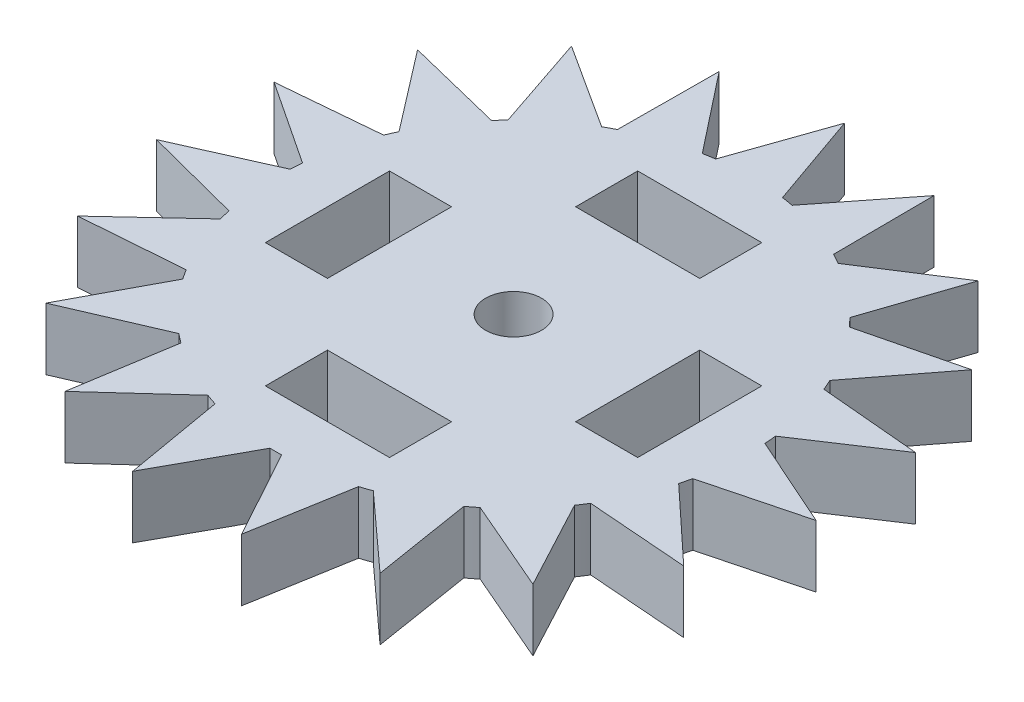
from build123d import *

# Parameters (mm, degrees)
SKETCH5_R           = 11.5
BOSS_EXTRUDE2_DEPTH = 3
BOSS_EXTRUDE1_DEPTH = 3
SKETCH3_W           = 6
SKETCH3_H           = 3
SKETCH3_W_2         = 3
SKETCH3_H_2         = 6
CUT_EXTRUDE1_DEPTH  = 3
SKETCH6_R           = 1.35
CUT_EXTRUDE3_DEPTH  = 3


with BuildPart() as part:
    # Sketch5 → Boss-Extrude2 (new body)
    with BuildSketch(Plane(origin=(0, 0, 0), x_dir=(1, 0, 0), z_dir=(0, 1, 0))):
        with Locations(Location((0, 0, 0), (0, 0, 270))):
            Circle(SKETCH5_R)
    extrude(amount=BOSS_EXTRUDE2_DEPTH)

    # Sketch1 → Boss-Extrude1 (add)
    with BuildSketch(Plane(origin=(0, 0, 0), x_dir=(1, 0, 0), z_dir=(0, 1, 0))):
        Polygon((0, 16), (-1.75, 11), (1.75, 11), align=None)
        Polygon((5.195191507, 15.133075867), (1.916513988, 10.97221373), (5.226874334, 9.835765588), align=None)
        Polygon((9.827403403, 12.62624815), (5.375343948, 9.755417851), (8.137335731, 7.605673356), align=None)
        Polygon((13.394663652, 8.75117053), (8.251671984, 7.481471076), (10.165990538, 4.551388402), align=None)
        Polygon((15.510404255, 3.927767794), (10.233803323, 4.396790824), (11.093002528, 1.003889893), align=None)
        Polygon((15.945351888, -1.321269528), (11.106943278, 0.835650063), (10.817915568, -2.652395663), align=None)
        Polygon((14.652373226, -6.427126794), (10.776473586, -2.81604635), (9.3705396, -6.021252993), align=None)
        Polygon((11.771582571, -10.836505146), (9.278205768, -6.162580444), (6.907720267, -8.737614132), align=None)
        Polygon((7.615158289, -14.071580019), (6.774500388, -8.841303325), (3.696342259, -10.507119201), align=None)
        Polygon((2.633513444, -15.781780854), (3.536672774, -10.561933804), (0.084408212, -11.13801487), align=None)
        Polygon((-2.633513444, -15.781780854), (-0.084408212, -11.13801487), (-3.536672774, -10.561933804), align=None)
        Polygon((-7.615158289, -14.071580019), (-3.696342259, -10.507119201), (-6.774500388, -8.841303325), align=None)
        Polygon((-11.771582571, -10.836505146), (-6.907720267, -8.737614132), (-9.278205768, -6.162580444), align=None)
        Polygon((-14.652373226, -6.427126794), (-9.3705396, -6.021252993), (-10.776473586, -2.81604635), align=None)
        Polygon((-15.945351888, -1.321269528), (-10.817915568, -2.652395663), (-11.106943278, 0.835650063), align=None)
        Polygon((-15.510404255, 3.927767794), (-11.093002528, 1.003889893), (-10.233803323, 4.396790824), align=None)
        Polygon((-13.394663652, 8.75117053), (-10.165990538, 4.551388402), (-8.251671984, 7.481471076), align=None)
        Polygon((-9.827403403, 12.62624815), (-8.137335731, 7.605673356), (-5.375343948, 9.755417851), align=None)
        Polygon((-5.195191507, 15.133075867), (-5.226874334, 9.835765588), (-1.916513988, 10.97221373), align=None)
    extrude(amount=BOSS_EXTRUDE1_DEPTH)

    # Sketch3 → Cut-Extrude1 (cut)
    with BuildSketch(Plane(origin=(0, 0, 0), x_dir=(1, 0, 0), z_dir=(0, 1, 0))):
        with Locations((0, 7.5)):
            Rectangle(SKETCH3_W, SKETCH3_H)
        with Locations((7.5, 0)):
            Rectangle(SKETCH3_W_2, SKETCH3_H_2)
        with Locations((0, -7.5)):
            Rectangle(SKETCH3_W, SKETCH3_H)
        with Locations((-7.5, 0)):
            Rectangle(SKETCH3_W_2, SKETCH3_H_2)
    extrude(amount=CUT_EXTRUDE1_DEPTH, mode=Mode.SUBTRACT)

    # Sketch6 → Cut-Extrude3 (cut)
    with BuildSketch(Plane(origin=(0, 3, 0), x_dir=(1, 0, 0), z_dir=(0, 1, 0))):
        with Locations(Location((0, 0, 0), (0, 0, 270))):
            Circle(SKETCH6_R)
    extrude(amount=-CUT_EXTRUDE3_DEPTH, mode=Mode.SUBTRACT)


solid = part.part
